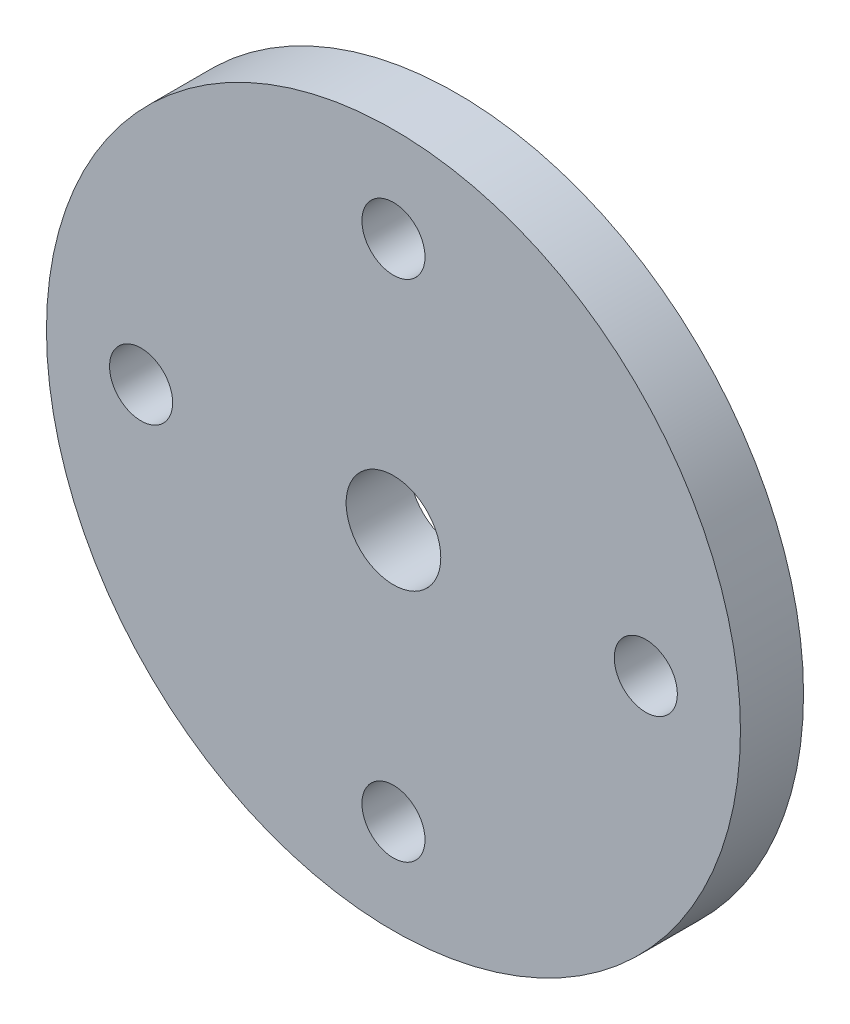
from build123d import *

# Parameters (mm, degrees)
SKETCH1_R           = 11
SKETCH1_R_2         = 1
SKETCH1_R_3         = 1.5
BOSS_EXTRUDE1_DEPTH = 2


with BuildPart() as part:
    # Sketch1 → Boss-Extrude1 (new body)
    with BuildSketch(Plane.XY):
        Circle(SKETCH1_R)
        with Locations((0, 8)):
            Circle(SKETCH1_R_2, mode=Mode.SUBTRACT)
        Circle(SKETCH1_R_3, mode=Mode.SUBTRACT)
        with Locations((8, 0)):
            Circle(SKETCH1_R_2, mode=Mode.SUBTRACT)
        with Locations((0, -8)):
            Circle(SKETCH1_R_2, mode=Mode.SUBTRACT)
        with Locations((-8, 0)):
            Circle(SKETCH1_R_2, mode=Mode.SUBTRACT)
    extrude(amount=BOSS_EXTRUDE1_DEPTH)


solid = part.part
